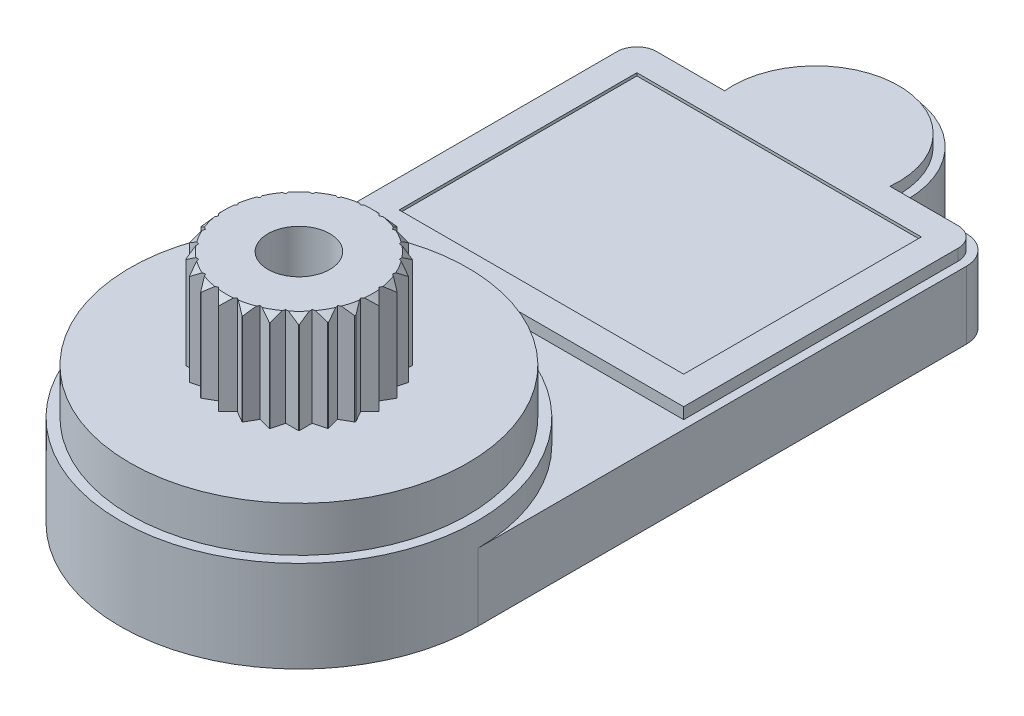
from build123d import *

# Parameters (mm, degrees)
SKETCH1_R           = 6.35
SKETCH1_R_2         = 1
BOSS_EXTRUDE1_DEPTH = 2.4
SKETCH2_R           = 6.35
BOSS_EXTRUDE2_DEPTH = 0.85
SKETCH3_R           = 6
BOSS_EXTRUDE3_DEPTH = 1.6
BOSS_EXTRUDE4_DEPTH = 3.5
SKETCH6_R           = 1.1
CUT_EXTRUDE1_DEPTH  = 4
BOSS_EXTRUDE5_DEPTH = 0.4
SKETCH8_W           = 10.1
SKETCH8_H           = 8.440176683
CUT_EXTRUDE2_DEPTH  = 0.1


with BuildPart() as part:
    # Sketch1 → Boss-Extrude1 (new body)
    with BuildSketch(Plane(origin=(0, 0, 0), x_dir=(1, 0, 0), z_dir=(0, 1, 0))):
        with Locations((0, -8.7)):
            Circle(SKETCH1_R)
        with BuildLine():
            Line((-3.25, 9.65), (-5.35, 9.65))
            ThreePointArc((-5.35, 9.65), (-4.642893219, 9.357106781), (-4.35, 8.65))
            ThreePointArc((-4.35, 8.65), (-5.350000006, 7.65), (-6.35, 8.650000012))
            Line((-6.35, 8.650000012), (-6.35, -8.700000013))
            ThreePointArc((-6.35, -8.700000013), (-7e-09, -2.35), (6.35, -8.7))
            Line((6.35, -8.7), (6.35, 8.65))
            ThreePointArc((6.35, 8.65), (4.642893215, 7.942893223), (5.350000012, 9.65))
            Line((5.350000012, 9.65), (3.25, 9.65))
            ThreePointArc((3.25, 9.65), (0, 6.4), (-3.25, 9.65))
        make_face()
        with Locations((-5.35, 8.65)):
            Circle(SKETCH1_R_2)
        with BuildLine():
            ThreePointArc((3.25, 9.65), (0, 12.9), (-3.25, 9.65))
            Line((-3.25, 9.65), (3.25, 9.65))
        make_face()
        with BuildLine():
            Line((3.25, 9.65), (-3.25, 9.65))
            ThreePointArc((-3.25, 9.65), (0, 6.4), (3.25, 9.65))
        make_face()
        with Locations((5.35, 8.65)):
            Circle(SKETCH1_R_2)
    extrude(amount=BOSS_EXTRUDE1_DEPTH)

    # Sketch2 → Boss-Extrude2 (add)
    with BuildSketch(Plane(origin=(0, 2.4, 0), x_dir=(-1, 0, 0), z_dir=(0, 1, 0))):
        with Locations(Location((0, 8.7, 0), (0, 0, 180))):
            Circle(SKETCH2_R)
    extrude(amount=BOSS_EXTRUDE2_DEPTH)

    # Sketch3 → Boss-Extrude3 (add)
    with BuildSketch(Plane(origin=(0, 3.25, 0), x_dir=(-1, 0, 0), z_dir=(0, 1, 0))):
        with Locations(Location((0, 8.7, 0), (0, 0, 90))):
            Circle(SKETCH3_R)
    extrude(amount=BOSS_EXTRUDE3_DEPTH)

    # Sketch4 → Boss-Extrude4 (add)
    with BuildSketch(Plane(origin=(0, 4.85, 0), x_dir=(-1, 0, 0), z_dir=(0, 1, 0))):
        Polygon((2.518440958, 8.368440958), (2.85, 8.7), (2.518440958, 9.031559042), (2.741390732, 9.417719379), (2.729517437, 9.451127629), (2.346813369, 9.672081926), (2.463209043, 10.106476495), (2.445926072, 10.130960886), (2.015254326, 10.246359032), (2.015254326, 10.700296057), (1.996868143, 10.715254326), (1.546359032, 10.715254326), (1.427678707, 11.15817533), (1.412422166, 11.16480218), (0.972081926, 11.046813369), (0.740314632, 11.448246096), (0.731654815, 11.44943636), (0.331559042, 11.218440958), (0, 11.55), (-0.331559042, 11.218440958), (-0.731654815, 11.44943636), (-0.740314632, 11.448246096), (-0.972081926, 11.046813369), (-1.412422166, 11.16480218), (-1.427678707, 11.15817533), (-1.546359032, 10.715254326), (-1.996868143, 10.715254326), (-2.015254326, 10.700296057), (-2.015254326, 10.246359032), (-2.445926072, 10.130960886), (-2.463209043, 10.106476495), (-2.346813369, 9.672081926), (-2.729517437, 9.451127629), (-2.741390732, 9.417719379), (-2.518440958, 9.031559042), (-2.85, 8.7), (-2.518440958, 8.368440958), (-2.752888605, 7.962365721), (-2.346813369, 7.727918074), (-2.468172401, 7.275), (-2.015254326, 7.153640968), (-2.015254326, 6.684745674), (-1.546359032, 6.684745674), (-1.425, 6.231827599), (-0.972081926, 6.353186631), (-0.737634279, 5.947111395), (-0.331559042, 6.181559042), (0, 5.85), (0.331559042, 6.181559042), (0.737634279, 5.947111395), (0.972081926, 6.353186631), (1.425, 6.231827599), (1.546359032, 6.684745674), (2.015254326, 6.684745674), (2.015254326, 7.153640968), (2.468172401, 7.275), (2.346813369, 7.727918074), (2.752888605, 7.962365721), align=None)
    extrude(amount=BOSS_EXTRUDE4_DEPTH)

    # Sketch5 → Cut-Revolve1 (revolve, cut)
    with BuildSketch(Plane(origin=(0, 0, 0), x_dir=(0, 0, -1), z_dir=(1, 0, 0))):
        Polygon((-6.9, 9.15), (-4.454839661, 9.15), (-4.454839661, 6.704839661), align=None)
    revolve(axis=Axis((0, 8.077813164, 8.7), (0, -1, 0)), mode=Mode.SUBTRACT)

    # Sketch6 → Cut-Extrude1 (cut)
    with BuildSketch(Plane(origin=(0, 8.35, 0), x_dir=(-1, 0, 0), z_dir=(0, 1, 0))):
        with Locations(Location((0, 8.7, 0), (0, 0, 90))):
            Circle(SKETCH6_R)
    extrude(amount=-CUT_EXTRUDE1_DEPTH, mode=Mode.SUBTRACT)

    # Sketch7 → Boss-Extrude5 (add)
    with BuildSketch(Plane(origin=(0, 2.4, 0), x_dir=(-1, 0, 0), z_dir=(0, 1, 0))):
        with BuildLine():
            Line((2.934706118, -9.35), (5.35, -9.35))
            ThreePointArc((5.35, -9.35), (5.844974747, -9.144974747), (6.05, -8.65))
            Line((6.05, -8.65), (6.05, 1.090176683))
            Line((6.05, 1.090176683), (-6.05, 1.090176683))
            Line((-6.05, 1.090176683), (-6.05, -1.654552581))
            Line((-6.05, -1.654552581), (-6.05, -8.65))
            ThreePointArc((-6.05, -8.65), (-5.844974747, -9.144974747), (-5.35, -9.35))
            Line((-5.35, -9.35), (-2.934706118, -9.35))
            ThreePointArc((-2.934706118, -9.35), (0, -12.6), (2.934706118, -9.35))
        make_face()
    extrude(amount=BOSS_EXTRUDE5_DEPTH)

    # Sketch8 → Cut-Extrude2 (cut)
    with BuildSketch(Plane(origin=(0, 2.8, 0), x_dir=(-1, 0, 0), z_dir=(0, 1, 0))):
        with Locations((0, -4.129911659)):
            Rectangle(SKETCH8_W, SKETCH8_H)
    extrude(amount=-CUT_EXTRUDE2_DEPTH, mode=Mode.SUBTRACT)


solid = part.part
